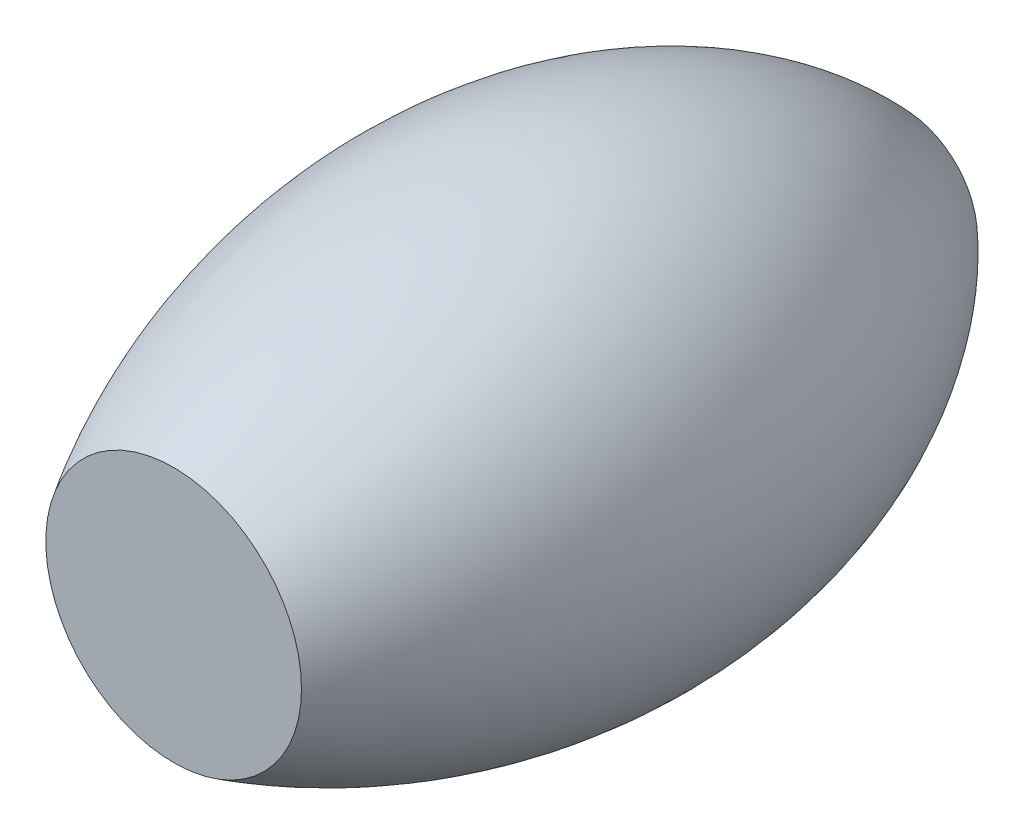
from build123d import *


with BuildPart() as part:
    # Croquis3 → Revolución1 (revolve)
    with BuildSketch(Plane(origin=(0, 0, 0), x_dir=(1, 0, 0), z_dir=(0, 1, 0))):
        with BuildLine():
            Line((-35, -100), (0, -100))
            Line((0, -100), (0, 100))
            Line((0, 100), (-20, 100))
            add(Edge.make_bspline(
                [(-20, 100), (-48.559991359, 74.100295123), (-74.019140196, 2.109278007), (-53.178655206, -70.205857952), (-35, -100)],
                knots=[0, 0, 0, 0, 0.514054732, 1, 1, 1, 1], degree=3))
        make_face()
    revolve(axis=Axis((0, 0, 100), (0, 0, -1)))


solid = part.part
